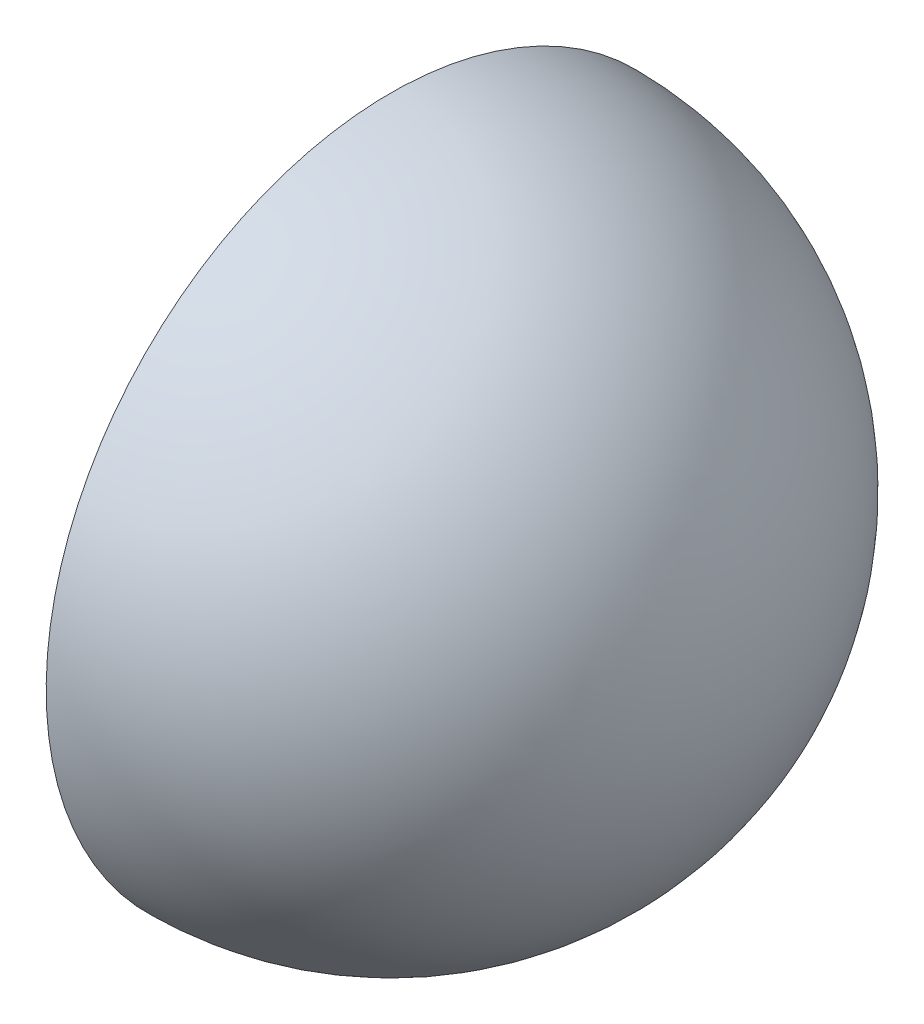
from build123d import *


with BuildPart() as part:
    # Sketch1 → Revolve1 (revolve)
    with BuildSketch(Plane.XY):
        with BuildLine():
            Line((189.317023445, -75), (189.317023445, -78))
            ThreePointArc((189.317023445, -78), (244.471352378, -55.154328933), (267.317023445, 0))
            Line((267.317023445, 0), (264.317023445, 0))
            ThreePointArc((264.317023445, 0), (242.350032034, -53.033008589), (189.317023445, -75))
        make_face()
    revolve(axis=Axis((189.317023445, 0, 0), (1, 0, 0)))


solid = part.part
